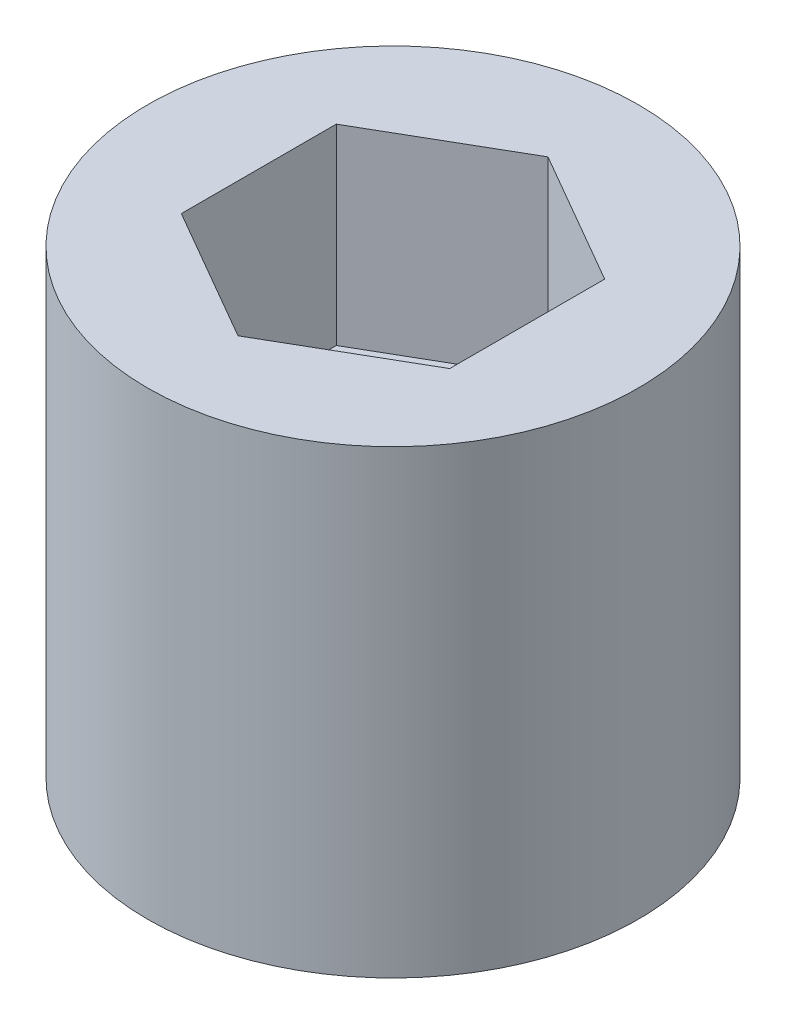
from build123d import *

# Parameters (mm, degrees)
SKETCH1_R           = 10.16
BOSS_EXTRUDE1_DEPTH = 19.05
CUT_EXTRUDE1_DEPTH  = 7.9375
SKETCH2_W           = 3.048
SKETCH2_H           = 3.048
CUT_EXTRUDE2_DEPTH  = 11.1125


with BuildPart() as part:
    # Sketch1 → Boss-Extrude1 (new body)
    with BuildSketch(Plane(origin=(0, 0, 0), x_dir=(1, 0, 0), z_dir=(0, 1, 0))):
        with Locations(Location((0, 0, 0), (0, 0, 90))):
            Circle(SKETCH1_R)
    extrude(amount=BOSS_EXTRUDE1_DEPTH)

    # Sketch3 → Cut-Extrude1 (cut)
    with BuildSketch(Plane(origin=(0, 19.05, 0), x_dir=(1, 0, 0), z_dir=(0, 1, 0))):
        Polygon((0, -6.415804866), (5.55625, -3.207902433), (5.55625, 3.207902433), (0, 6.415804866), (-5.55625, 3.207902433), (-5.55625, -3.207902433), align=None)
    extrude(amount=-CUT_EXTRUDE1_DEPTH, mode=Mode.SUBTRACT)

    # Sketch2 → Cut-Extrude2 (cut)
    with BuildSketch(Plane(origin=(0, 0, 0), x_dir=(-1, 0, 0), z_dir=(0, -1, 0))):
        Rectangle(SKETCH2_W, SKETCH2_H)
    extrude(amount=-CUT_EXTRUDE2_DEPTH, mode=Mode.SUBTRACT)


solid = part.part
